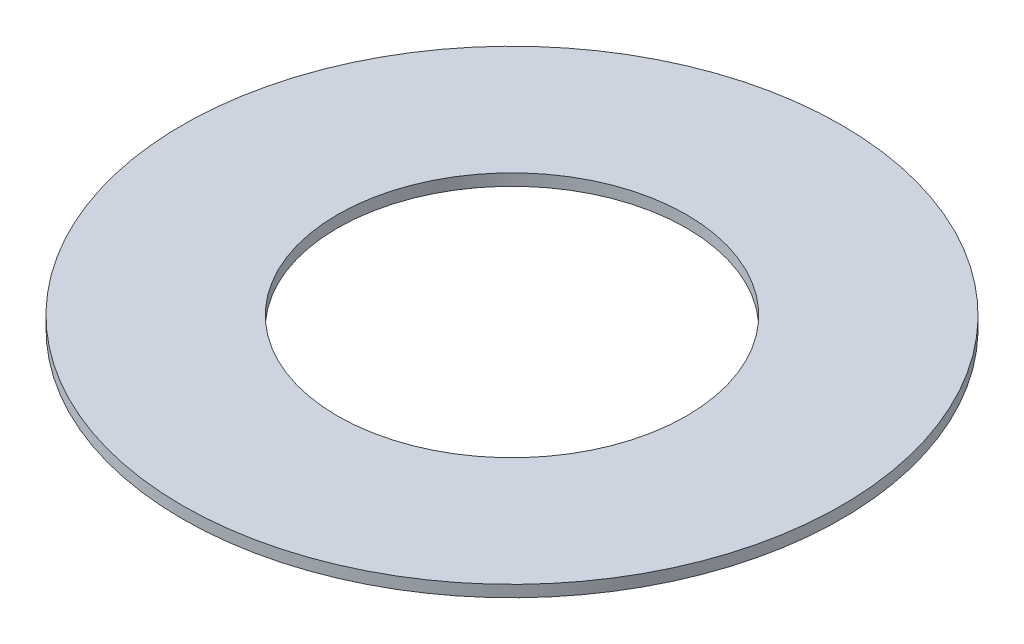
from build123d import *

# Parameters (mm, degrees)
SKETCH1_R           = 8.5
SKETCH1_R_2         = 4.5
BOSS_EXTRUDE1_DEPTH = 0.15


with BuildPart() as part:
    # Sketch1 → Boss-Extrude1 (new, symmetric)
    with BuildSketch(Plane(origin=(0, 0, 0), x_dir=(1, 0, 0), z_dir=(0, 1, 0))):
        with Locations(Location((0, 0, 0), (0, 0, 270))):
            Circle(SKETCH1_R)
        with Locations(Location((0, 0, 0), (0, 0, 270))):
            Circle(SKETCH1_R_2, mode=Mode.SUBTRACT)
    extrude(amount=BOSS_EXTRUDE1_DEPTH, both=True)


solid = part.part
